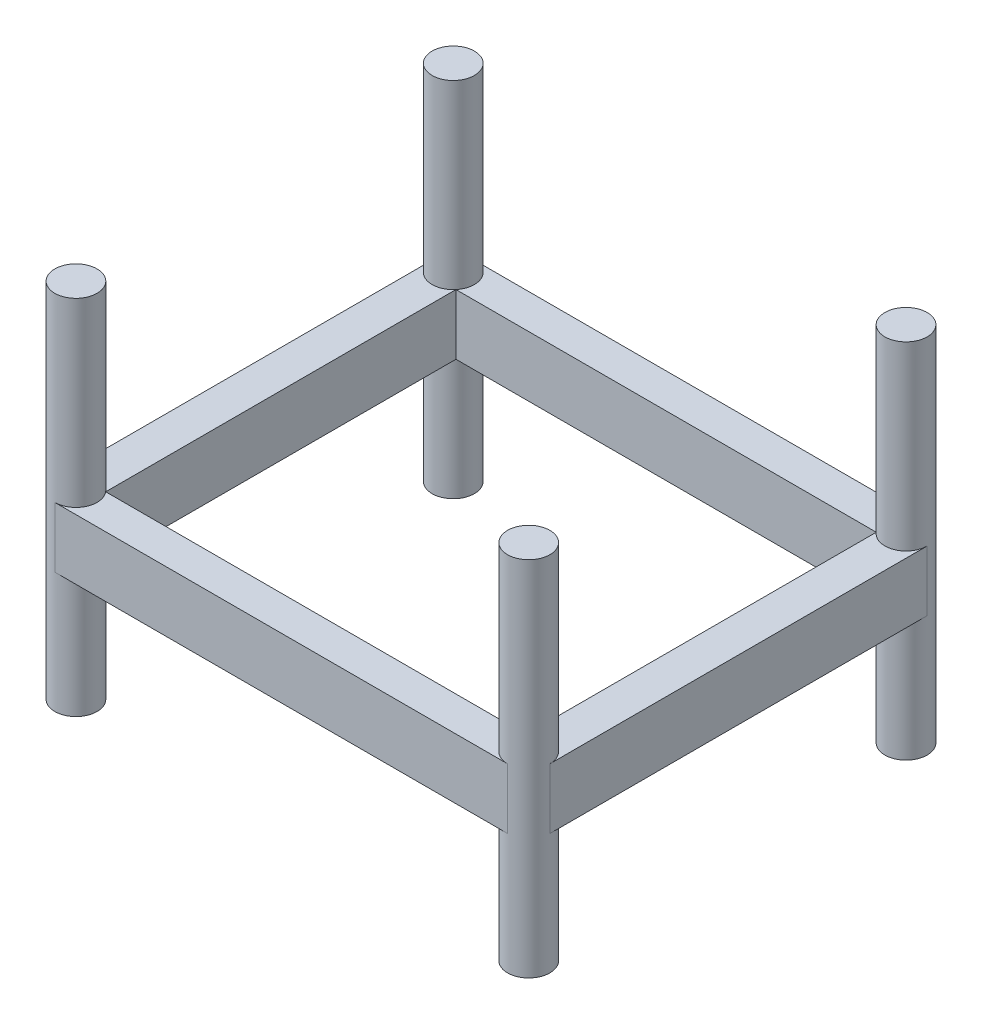
from build123d import *

# Parameters (mm, degrees)
SKETCH2_W                = 35.36820513
SKETCH2_H                = 29.473504274
BOSS_EXTRUDE1_DEPTH      = 5.08
BOSS_EXTRUDE2_DEPTH      = 15.24
BOSS_EXTRUDE2_DEPTH_BACK = 15.24
SKETCH3_R                = 1.778


with BuildPart() as part:
    # Sketch2 → Boss-Extrude1 (new body)
    with BuildSketch(Plane(origin=(0, 0, 0), x_dir=(1, 0, 0), z_dir=(0, 1, 0))):
        with BuildLine():
            Line((-20.828, -15.875), (-20.828, 15.875))
            ThreePointArc((-20.828, 15.875), (-20.307235857, 17.132235857), (-19.05, 17.653))
            Line((-19.05, 17.653), (19.05, 17.653))
            ThreePointArc((19.05, 17.653), (20.307235857, 17.132235857), (20.828, 15.875))
            Line((20.828, 15.875), (20.828, -15.875))
            ThreePointArc((20.828, -15.875), (20.307235857, -17.132235857), (19.05, -17.653))
            Line((19.05, -17.653), (-19.05, -17.653))
            ThreePointArc((-19.05, -17.653), (-20.307235857, -17.132235857), (-20.828, -15.875))
        make_face()
        Rectangle(SKETCH2_W, SKETCH2_H, mode=Mode.SUBTRACT)
    extrude(amount=BOSS_EXTRUDE1_DEPTH)

    # Sketch3 → Boss-Extrude2 (add, two sides: drawn at the far end of the back side and taken through both)
    with BuildSketch(Plane(origin=(0, 5.08, 0), x_dir=(1, 0, 0), z_dir=(0, 1, 0)).offset(-BOSS_EXTRUDE2_DEPTH_BACK)):
        with Locations(Location((-19.05, -15.875, 0), (0, 0, 270))):
            Circle(SKETCH3_R)
        with Locations(Location((19.05, -15.875, 0), (0, 0, 270))):
            Circle(SKETCH3_R)
        with Locations(Location((19.05, 15.875, 0), (0, 0, 270))):
            Circle(SKETCH3_R)
        with Locations(Location((-19.05, 15.875, 0), (0, 0, 270))):
            Circle(SKETCH3_R)
    extrude(amount=BOSS_EXTRUDE2_DEPTH + BOSS_EXTRUDE2_DEPTH_BACK)


solid = part.part
